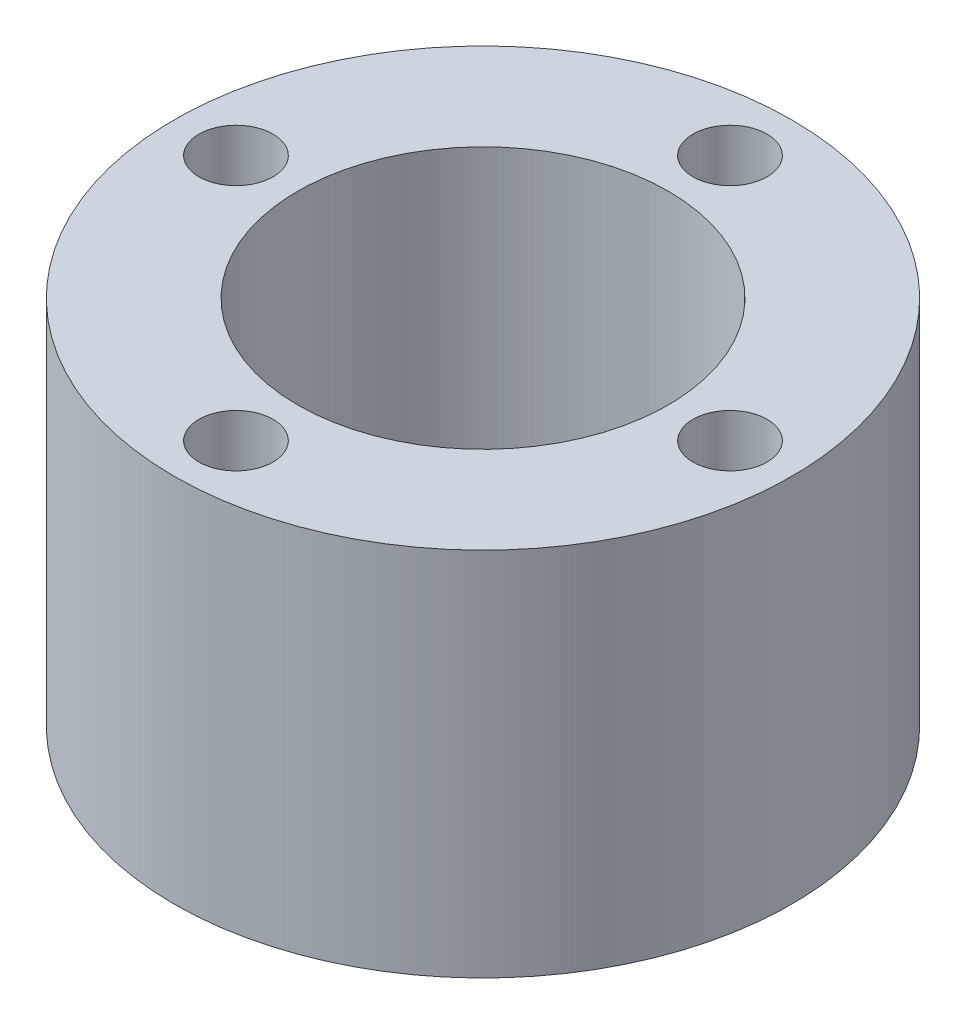
from build123d import *

# Parameters (mm, degrees)
SKETCH1_R           = 25
SKETCH1_R_2         = 15
BOSS_EXTRUDE1_DEPTH = 30
SKETCH2_R           = 3
CUT_EXTRUDE1_DEPTH  = 30


with BuildPart() as part:
    # Sketch1 → Boss-Extrude1 (new body)
    with BuildSketch(Plane(origin=(0, 0, 0), x_dir=(1, 0, 0), z_dir=(0, 1, 0))):
        with Locations(Location((0, 0, 0), (0, 0, 270))):
            Circle(SKETCH1_R)
        with Locations(Location((0, 0, 0), (0, 0, 270))):
            Circle(SKETCH1_R_2, mode=Mode.SUBTRACT)
    extrude(amount=BOSS_EXTRUDE1_DEPTH)

    # Sketch2 → Cut-Extrude1 (cut)
    with BuildSketch(Plane(origin=(0, 30, 0), x_dir=(1, 0, 0), z_dir=(0, 1, 0))):
        with Locations(Location((0, 20, 0), (0, 0, 270))):
            Circle(SKETCH2_R)
        with Locations(Location((20, 0, 0), (0, 0, 270))):
            Circle(SKETCH2_R)
        with Locations(Location((0, -20, 0), (0, 0, 270))):
            Circle(SKETCH2_R)
        with Locations(Location((-20, 0, 0), (0, 0, 270))):
            Circle(SKETCH2_R)
    extrude(amount=-CUT_EXTRUDE1_DEPTH, mode=Mode.SUBTRACT)


solid = part.part
